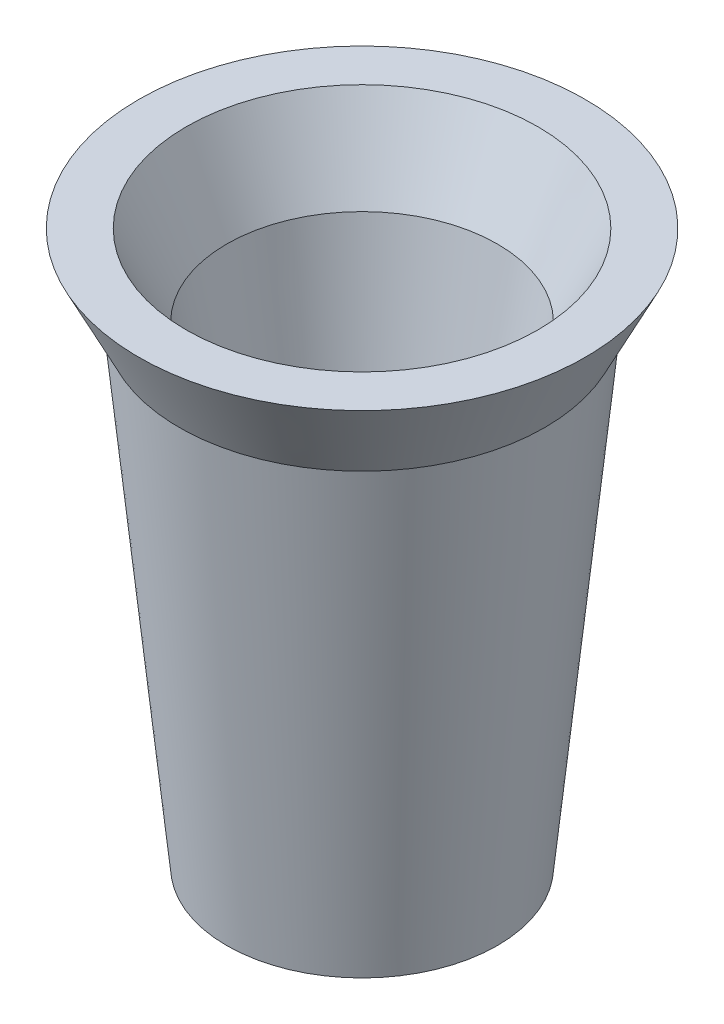
from build123d import *


with BuildPart() as part:
    # 草图1 → 旋转1 (revolve)
    with BuildSketch(Plane.XY, mode=Mode.PRIVATE) as revolve_1_sk:
        Polygon((50, 0), (67.5, 174.5), (50, 174.5), (17.5, 0), align=None)
        Polygon((82.5, 204.5), (67.5, 174.5), (50, 174.5), (65, 204.5), align=None)
    revolve(revolve_1_sk.sketch.rotate(Axis((0, 174.5, 0), (0, -1, 0)), 180), axis=Axis((0, 174.5, 0), (0, -1, 0)))


solid = part.part
